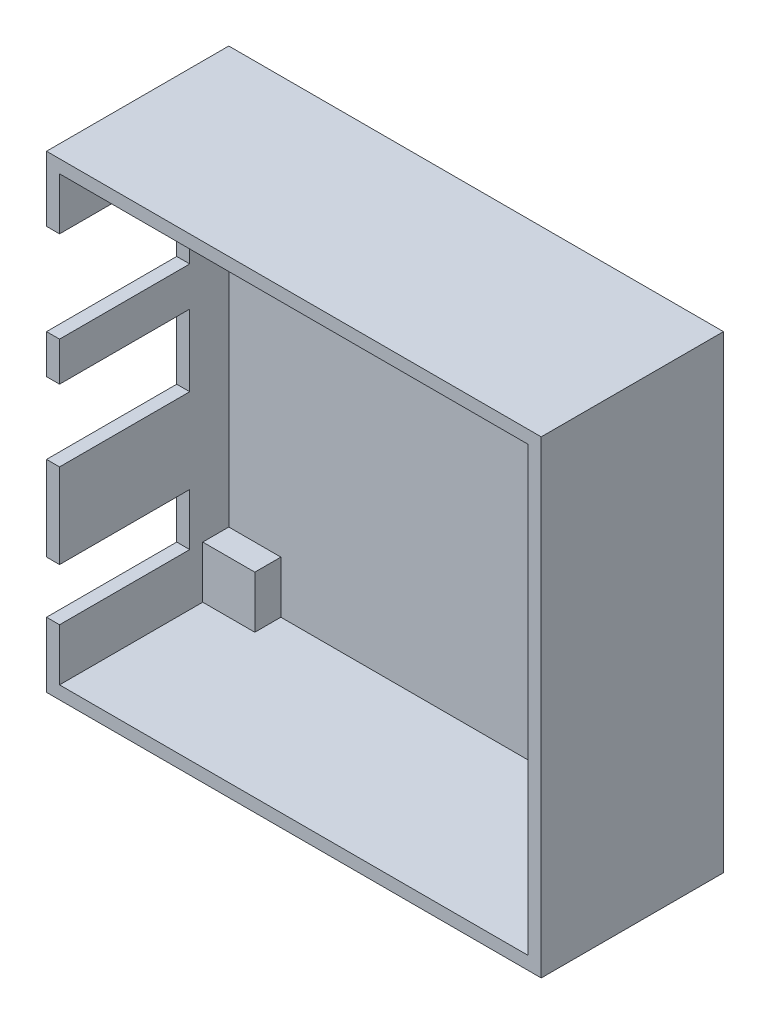
from build123d import *

# Parameters (mm, degrees)
ESQUISSE1_W             = 76
ESQUISSE1_H             = 72
BOSS_EXTRU_1_DEPTH      = 2
ESQUISSE2_W             = 76
ESQUISSE2_H             = 72
ESQUISSE2_W_2           = 72
ESQUISSE2_H_2           = 68
BOSS_EXTRU_2_DEPTH      = 26
ESQUISSE3_W             = 8
ESQUISSE3_H             = 8
BOSS_EXTRU_3_DEPTH      = 4
ESQUISSE4_W             = 12.488308145
ESQUISSE4_H             = 8
ESQUISSE4_W_2           = 11.866165586
ESQUISSE4_H_2           = 11
ESQUISSE4_W_3           = 11.945061533
ESQUISSE4_H_3           = 14
ENL_V_MAT_EXTRU_1_DEPTH = 87.526649953


with BuildPart() as part:
    # Esquisse1 → Boss.-Extru.1 (new body)
    with BuildSketch(Plane.XY):
        with Locations((-32.138593491, 10.555760709)):
            Rectangle(ESQUISSE1_W, ESQUISSE1_H)
    extrude(amount=BOSS_EXTRU_1_DEPTH)

    # Esquisse2 → Boss.-Extru.2 (add)
    with BuildSketch(Plane.XY.offset(2)):
        with Locations((-32.138593491, 10.555760709)):
            Rectangle(ESQUISSE2_W, ESQUISSE2_H)
        with Locations((-32.138593491, 10.555760709)):
            Rectangle(ESQUISSE2_W_2, ESQUISSE2_H_2, mode=Mode.SUBTRACT)
    extrude(amount=BOSS_EXTRU_2_DEPTH)

    # Esquisse3 → Boss.-Extru.3 (add)
    with BuildSketch(Plane.XY.offset(2)):
        with Locations((-64.138593491, 40.555760709)):
            Rectangle(ESQUISSE3_W, ESQUISSE3_H)
        with Locations((-0.138593491, -19.444239291)):
            Rectangle(ESQUISSE3_W, ESQUISSE3_H)
        with Locations((-0.138593491, 40.555760709)):
            Rectangle(ESQUISSE3_W, ESQUISSE3_H)
        with Locations((-64.138593491, -19.444239291)):
            Rectangle(ESQUISSE3_W, ESQUISSE3_H)
    extrude(amount=BOSS_EXTRU_3_DEPTH)

    # Esquisse4 → Enlèv. mat.-Extru.1 (cut, through all)
    with BuildSketch(Plane.XY.offset(8)):
        with Locations((-68.655939158, -11.444239291)):
            Rectangle(ESQUISSE4_W, ESQUISSE4_H)
        with Locations((-68.344867878, 11.055760709)):
            Rectangle(ESQUISSE4_W_2, ESQUISSE4_H_2)
        with Locations((-70.945478816, 29.555760709)):
            Rectangle(ESQUISSE4_W_3, ESQUISSE4_H_3)
    extrude(amount=ENL_V_MAT_EXTRU_1_DEPTH, mode=Mode.SUBTRACT)


solid = part.part
